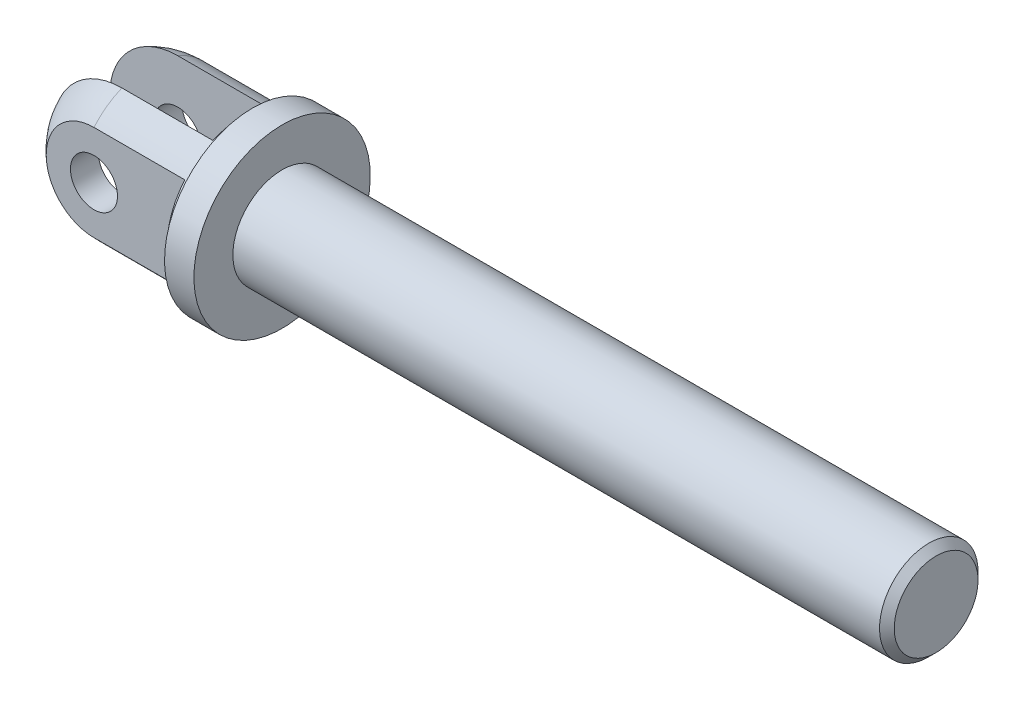
from build123d import *

# Parameters (mm, degrees)
SKETCH_3_W          = 10.261040874
SKETCH_3_H          = 1.404819466
CUT_EXTRUDE_1_DEPTH = 50
SKETCH_4_W          = 11.206560307
SKETCH_4_H          = 3.8
CUT_EXTRUDE_2_DEPTH = 50
SKETCH_7_R          = 1.6
CUT_EXTRUDE_4_DEPTH = 62.286866456


with BuildPart() as part:
    # 草图2 → 旋转1 (revolve)
    with BuildSketch(Plane.XY.offset(-1.8)):
        with BuildLine():
            Line((6.7, 5), (13.7, 5))
            Line((13.7, 5), (13.7, 6))
            Line((13.7, 6), (15.7, 6))
            Line((15.7, 6), (15.7, 3.35))
            Line((15.7, 3.35), (59.7, 3.35))
            Line((59.7, 3.35), (60.2, 2.85))
            Line((60.2, 2.85), (60.2, 0))
            Line((60.2, 0), (1.7, 0))
            ThreePointArc((1.7, 0), (3.164466094, 3.535533906), (6.7, 5))
        make_face()
    revolve(axis=Axis((60.2, 0, -1.8), (-1, 0, 0)))

    # 草图3 → 切除-拉伸1 (cut, symmetric)
    with BuildSketch(Plane(origin=(0, 0, -1.8), x_dir=(1, 0, 0), z_dir=(0, 1, 0))):
        with Locations((7.747323823, -4.502409733)):
            Rectangle(SKETCH_3_W, SKETCH_3_H)
        with Locations((7.747323823, 4.502409733)):
            Rectangle(SKETCH_3_W, SKETCH_3_H)
    extrude(amount=CUT_EXTRUDE_1_DEPTH, both=True, mode=Mode.SUBTRACT)

    # 草图4 → 切除-拉伸2 (cut, symmetric)
    with BuildSketch(Plane(origin=(0, 0, 0), x_dir=(1, 0, 0), z_dir=(0, 1, 0))):
        with Locations((7.274564107, 1.8)):
            Rectangle(SKETCH_4_W, SKETCH_4_H)
    extrude(amount=CUT_EXTRUDE_2_DEPTH, both=True, mode=Mode.SUBTRACT)

    # 草图7 → 切除-拉伸4 (cut, through all)
    with BuildSketch(Plane.XY.offset(2)):
        with Locations((6.7, 0)):
            Circle(SKETCH_7_R)
    extrude(amount=-CUT_EXTRUDE_4_DEPTH, mode=Mode.SUBTRACT)


solid = part.part
